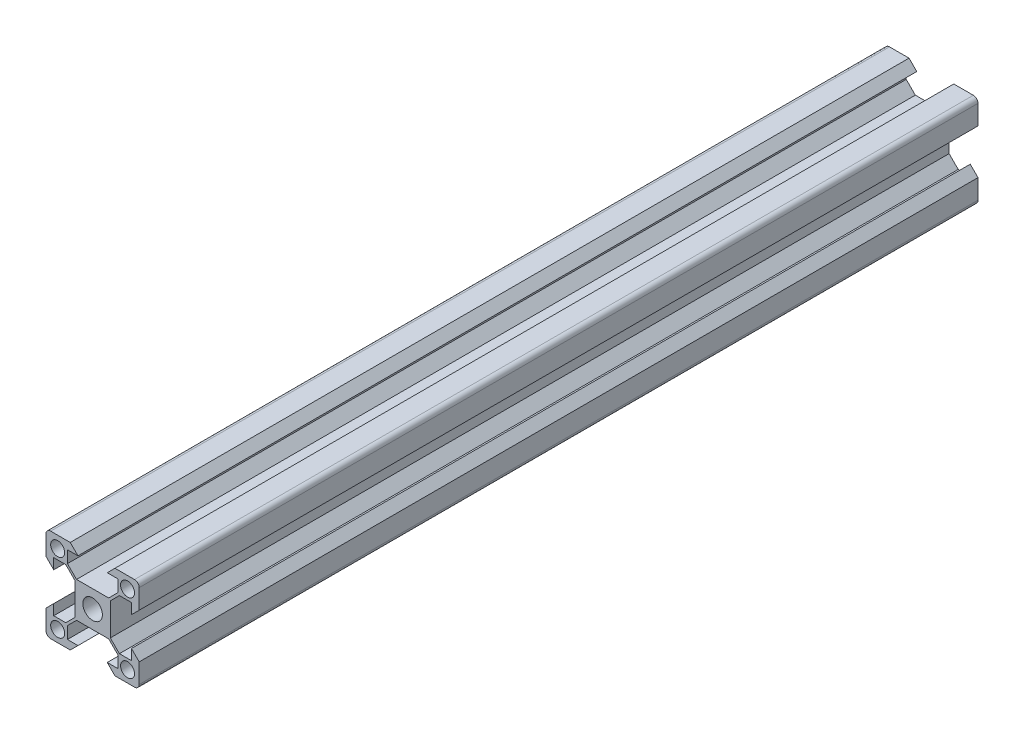
from build123d import *

# Parameters (mm, degrees)
SKETCH_1_R      = 1.5
SKETCH_1_R_2    = 2.1
EXTRUDE_1_DEPTH = 90
FILLET_1_R      = 1


with BuildPart() as part:
    # 草图1 → 凸台-拉伸1 (new, symmetric)
    with BuildSketch(Plane.XY):
        Polygon((-10, 10), (-10, 4.8), (-8.34, 3.14), (-8.34, 5.4), (-5.753553391, 5.4), (-3.8, 3.446446609), (-3.8, -3.446446609), (-5.753553391, -5.4), (-8.34, -5.4), (-8.34, -3.14), (-10, -4.8), (-10, -10), (-4.8, -10), (-3.14, -8.34), (-5.4, -8.34), (-5.4, -5.753553391), (-3.446446609, -3.8), (3.446446609, -3.8), (5.4, -5.753553391), (5.4, -8.34), (3.14, -8.34), (4.8, -10), (10, -10), (10, -4.8), (8.34, -3.14), (8.34, -5.4), (5.753553391, -5.4), (3.8, -3.446446609), (3.8, 3.446446609), (5.753553391, 5.4), (8.34, 5.4), (8.34, 3.14), (10, 4.8), (10, 10), (4.8, 10), (3.14, 8.34), (5.4, 8.34), (5.4, 5.753553391), (3.446446609, 3.8), (-3.446446609, 3.8), (-5.4, 5.753553391), (-5.4, 8.34), (-3.14, 8.34), (-4.8, 10), align=None)
        with Locations(Location((-7.5, 7.5, 0), (0, 0, 180))):
            Circle(SKETCH_1_R, mode=Mode.SUBTRACT)
        with Locations(Location((0, 0, 0), (0, 0, 180))):
            Circle(SKETCH_1_R_2, mode=Mode.SUBTRACT)
        with Locations(Location((-7.5, -7.5, 0), (0, 0, 180))):
            Circle(SKETCH_1_R, mode=Mode.SUBTRACT)
        with Locations(Location((7.5, -7.5, 0), (0, 0, 180))):
            Circle(SKETCH_1_R, mode=Mode.SUBTRACT)
        with Locations(Location((7.5, 7.5, 0), (0, 0, 180))):
            Circle(SKETCH_1_R, mode=Mode.SUBTRACT)
    extrude(amount=EXTRUDE_1_DEPTH, both=True)

    # 圆角1
    fillet_1_edges = [part.edges().sort_by_distance(p)[0] for p in [
        (10, 10, 0),
        (10, -10, 0),
        (-10, -10, 0),
        (-10, 10, 0),
    ]]
    fillet(fillet_1_edges, radius=FILLET_1_R)


solid = part.part
